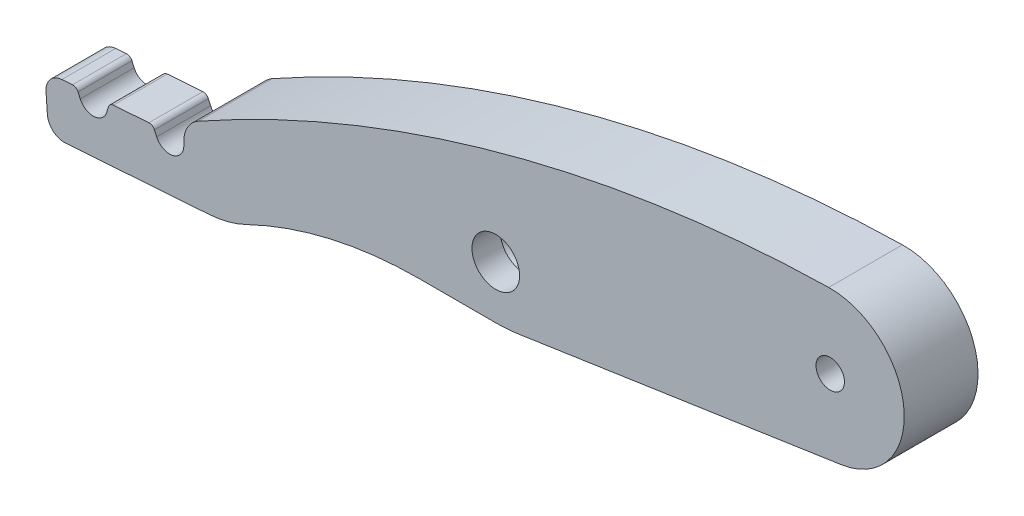
from build123d import *

# Parameters (mm, degrees)
BOSS_EXTRUDE1_DEPTH          = 3.5
BOSS_EXTRUDE2_DEPTH          = 9.5
BOSS_EXTRUDE2_DEPTH_BACK     = 3.5
CUT_EXTRUDE1_DEPTH           = 268.941422383
SKETCH4_W                    = 15
SKETCH4_H                    = 13
CUT_EXTRUDE2_DEPTH           = 8
F_5_16_CLEARANCE_HOLE1_D     = 8.4
F_5_16_CLEARANCE_HOLE1_DEPTH = 13
FILLET1_R                    = 1
FILLET2_R                    = 3
FILLET3_R                    = 3.5
FILLET4_R                    = 5
FILLET5_R                    = 18
FILLET6_R                    = 27.432772437
SKETCH9_R                    = 2.51
CUT_EXTRUDE3_DEPTH           = 268.881580074
CUT_EXTRUDE4_DEPTH           = 3.5


with BuildPart() as part:
    # Sketch1 → Boss-Extrude1 (new body)
    with BuildSketch(Plane.XY.offset(47.8)):
        with BuildLine():
            Line((-55.017772963, 219.948002855), (-50.996862784, 212.056522295))
            Line((-50.996862784, 212.056522295), (-46.846659232, 212.346732798))
            ThreePointArc((-46.846659232, 212.346732798), (-30.700707895, 218.653781383), (-13.5, 220.8))
            Line((-13.5, 220.8), (2.038607139, 220.8))
            Line((2.038607139, 220.8), (60.876238897, 229.593342983))
            ThreePointArc((60.876238897, 229.593342983), (71.950599997, 243.603343771), (58.674027502, 255.547137919))
            ThreePointArc((58.674027502, 255.547137919), (-0.148756736, 246.886614708), (-54.989372002, 223.916383428))
            Line((-54.989372002, 223.916383428), (-54.989372002, 220.323766337))
            ThreePointArc((-54.989372002, 220.323766337), (-54.996482354, 220.13534871), (-55.017772963, 219.948002855))
        make_face()
    extrude(amount=-BOSS_EXTRUDE1_DEPTH)

    # Sketch2 → Boss-Extrude2 (add, two sides: drawn at the far end of the back side and taken through both)
    with BuildSketch(Plane(origin=(0, 0, 44.3), x_dir=(-1, 0, 0), z_dir=(0, 0, -1)).offset(-BOSS_EXTRUDE2_DEPTH_BACK)):
        with BuildLine():
            Line((60.44632379, 220.818705454), (79.484610639, 219.487418749))
            Line((79.484610639, 219.487418749), (78.828899786, 210.110316677))
            Line((78.828899786, 210.110316677), (46.846659232, 212.346732798))
            ThreePointArc((46.846659232, 212.346732798), (30.700707895, 218.653781383), (13.5, 220.8))
            Line((13.5, 220.8), (-2.038607139, 220.8))
            Line((-2.038607139, 220.8), (-60.876238897, 229.593342983))
            ThreePointArc((-60.876238897, 229.593342983), (-71.950599997, 243.603343771), (-58.674027502, 255.547137919))
            ThreePointArc((-58.674027502, 255.547137919), (0.148756736, 246.886614708), (54.989372002, 223.916383428))
            Line((54.989372002, 223.916383428), (54.989372002, 220.323766337))
            ThreePointArc((54.989372002, 220.323766337), (56.969592775, 217.878397335), (59.773235646, 219.306924729))
            Line((59.773235646, 219.306924729), (60.44632379, 220.818705454))
        make_face()
    extrude(amount=BOSS_EXTRUDE2_DEPTH + BOSS_EXTRUDE2_DEPTH_BACK)

    # Sketch3 → Cut-Extrude1 (cut, through all)
    with BuildSketch(Plane(origin=(0, 0, 34.8), x_dir=(-1, 0, 0), z_dir=(0, 0, -1))):
        with BuildLine():
            Line((73.913438469, 219.876993058), (68.097193955, 220.283704494))
            Line((68.097193955, 220.283704494), (68.55333244, 218.692960552))
            ThreePointArc((68.55333244, 218.692960552), (70.782095496, 216.888143816), (73.240350324, 218.365212333))
            Line((73.240350324, 218.365212333), (73.913438469, 219.876993058))
        make_face()
    extrude(amount=-CUT_EXTRUDE1_DEPTH, mode=Mode.SUBTRACT)

    # Sketch4 → Cut-Extrude2 (cut)
    with BuildSketch(Plane(origin=(0, 0, 34.8), x_dir=(-1, 0, 0), z_dir=(0, 0, -1))):
        with Locations((0, 230.1)):
            Rectangle(SKETCH4_W, SKETCH4_H)
    extrude(amount=-CUT_EXTRUDE2_DEPTH, mode=Mode.SUBTRACT)

    # 5/16 Clearance Hole1
    with Locations(Plane.XY.offset(47.8)):
        with Locations((0, 230.1)):
            Hole(F_5_16_CLEARANCE_HOLE1_D / 2, depth=F_5_16_CLEARANCE_HOLE1_DEPTH)

    # Fillet1
    fillet1_edges = [part.edges().sort_by_distance(p)[0] for p in [
        (-60.44632379, 220.818705454, 41.3),
        (-73.913438469, 219.876993058, 41.3),
        (-68.097193955, 220.283704494, 41.3),
    ]]
    fillet(fillet1_edges, radius=FILLET1_R)

    # Fillet2
    fillet2_edges = [part.edges().sort_by_distance(p)[0] for p in [
        (-79.484610639, 219.487418749, 41.3),
        (-78.828899786, 210.110316677, 41.3),
    ]]
    fillet(fillet2_edges, radius=FILLET2_R)

    # Fillet3
    fillet3_edges = [part.edges().sort_by_distance(p)[0] for p in [
        (-7.5, 236.6, 38.8),
        (-7.5, 223.6, 38.8),
        (7.5, 223.6, 38.8),
        (7.5, 236.6, 38.8),
    ]]
    fillet(fillet3_edges, radius=FILLET3_R)

    # Fillet4
    fillet4_edges = [part.edges().sort_by_distance(p)[0] for p in [
        (-54.989372002, 223.916383428, 41.3),
    ]]
    fillet(fillet4_edges, radius=FILLET4_R)

    # Fillet5
    fillet5_edges = [part.edges().sort_by_distance(p)[0] for p in [
        (-46.846659232, 212.346732798, 41.3),
    ]]
    fillet(fillet5_edges, radius=FILLET5_R)

    # Fillet6
    fillet6_edges = [part.edges().sort_by_distance(p)[0] for p in [
        (2.038607139, 220.8, 41.3),
    ]]
    fillet(fillet6_edges, radius=FILLET6_R)

    # Sketch9 → Cut-Extrude3 (cut, through all)
    with BuildSketch(Plane(origin=(0, 0, 34.8), x_dir=(-1, 0, 0), z_dir=(0, 0, -1))):
        with Locations((-58.947326081, 242.5)):
            Circle(SKETCH9_R)
    extrude(amount=-CUT_EXTRUDE3_DEPTH, mode=Mode.SUBTRACT)

    # Sketch10 → Cut-Extrude4 (cut)
    with BuildSketch(Plane(origin=(0, 0, 34.8), x_dir=(-1, 0, 0), z_dir=(0, 0, -1))):
        Polygon((50.996862784, 212.056522295), (55.017772963, 219.948002855), (56.636135003, 223.124217196), (80.862126047, 221.430170876), (79.948532306, 208.3651717), (50.433855775, 210.429038936), align=None)
    extrude(amount=-CUT_EXTRUDE4_DEPTH, mode=Mode.SUBTRACT)


solid = part.part
